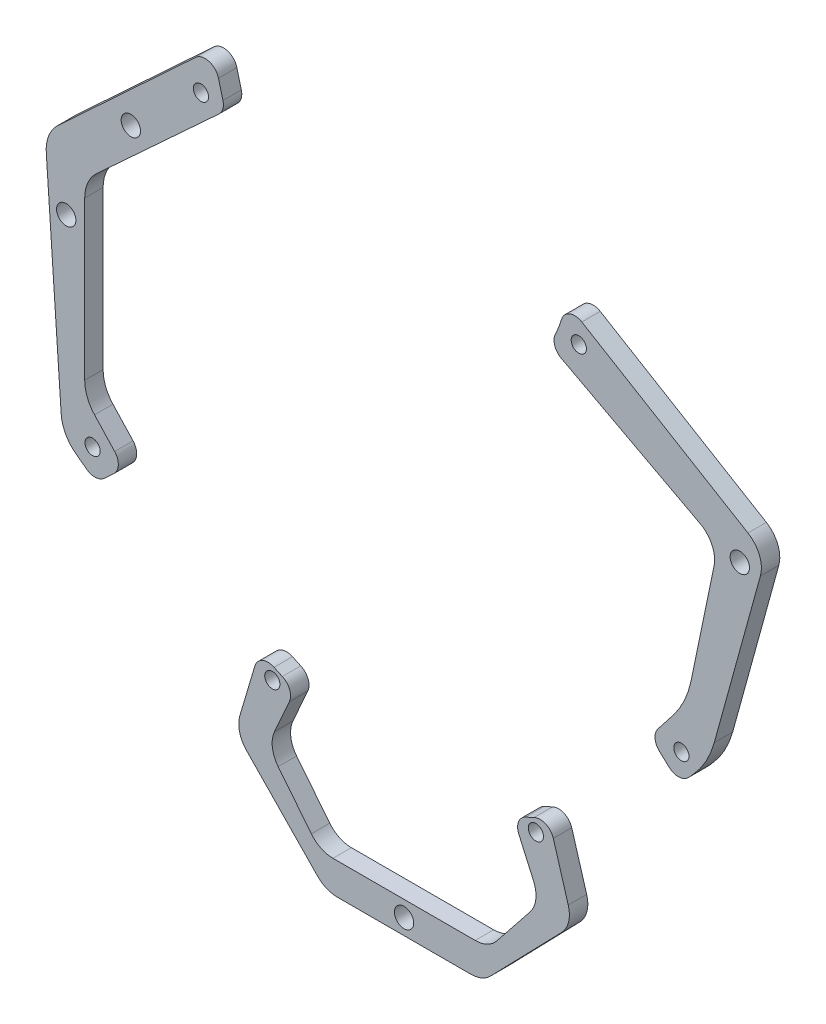
from build123d import *

# Parameters (mm, degrees)
SKETCH_1_R      = 1.65
SKETCH_1_R_2    = 2.1
EXTRUDE_1_DEPTH = 4
FILLET_1_R      = 20
FILLET_2_R      = 3
FILLET_3_R      = 6
FILLET_4_R      = 3
FILLET_5_R      = 3
FILLET_6_R      = 6
FILLET_7_R      = 6
FILLET_8_R      = 3
FILLET_9_R      = 8


with BuildPart() as part:
    # 草图1 → 凸台-拉伸1 (new body)
    # profile 1 of 5: a face of its own
    with BuildSketch(Plane.XY):
        Polygon((-77.945405083, 2.604841831), (-41.566231945, 36.364781808), (-38.875318831, 26.038559191), (-69.339571839, -2.044157442), (-69.339571839, -42.939996997), (-60.801466828, -52.154864748), (-66.909557952, -57.814362512), (-74.194826339, -52.394150256), align=None)
        with Locations((-44.1, 26.89)):
            Circle(SKETCH_1_R, mode=Mode.SUBTRACT)
        with Locations((-67.632870637, -51.487254798)):
            Circle(SKETCH_1_R, mode=Mode.SUBTRACT)
        with Locations((-59.326738736, 13.103569808)):
            Circle(SKETCH_1_R_2, mode=Mode.SUBTRACT)
        with Locations((-73.356046193, -10.69429247)):
            Circle(SKETCH_1_R_2, mode=Mode.SUBTRACT)
    # profile 2 of 5: a face of its own
    with BuildSketch(Plane.XY):
        with BuildLine():
            ThreePointArc((31.376803603, 17.505732499), (33.128070546, 20.566305741), (34.314610381, 23.886873116))
            Line((34.314610381, 23.886873116), (35.166942334, 27.157647426))
            Line((35.166942334, 27.157647426), (78.569062885, 1.124085584))
            Line((78.569062885, 1.124085584), (66.046380792, -44.316295638))
            Line((66.046380792, -44.316295638), (59.715665593, -51.148807449))
            Line((59.715665593, -51.148807449), (53.416137419, -45.311932247))
            Line((53.416137419, -45.311932247), (61.341189712, -35.154345924))
            Line((61.341189712, -35.154345924), (68.210178439, -2.044157442))
            Line((68.210178439, -2.044157442), (31.376803603, 17.505732499))
        make_face()
        with Locations((37.929803622, 20.552893435)):
            Circle(SKETCH_1_R, mode=Mode.SUBTRACT)
        with Locations((60.201437699, -44.933461153)):
            Circle(SKETCH_1_R, mode=Mode.SUBTRACT)
        with Locations((72.892421676, -2.924569169)):
            Circle(SKETCH_1_R_2, mode=Mode.SUBTRACT)
    # profile 3 of 5: a face of its own
    with BuildSketch(Plane.XY):
        with BuildLine():
            Line((36.641886012, -89.35704275), (31.376803603, -71.627696822))
            ThreePointArc((31.376803603, -71.627696822), (27.572746465, -73.545827587), (23.652041706, -75.212606079))
            Line((23.652041706, -75.212606079), (29.612111549, -88.598929818))
            Line((29.612111549, -88.598929818), (18.333166842, -102.74766519))
            Line((18.333166842, -102.74766519), (6.109482288, -102.74766519))
            ThreePointArc((6.109482288, -102.74766519), (6.773713015, -104.398972349), (7, -106.164421864))
            ThreePointArc((7, -106.164421864), (6.773713015, -107.92987138), (6.109482288, -109.581178539))
            Line((6.109482288, -109.581178539), (17.028290172, -109.581178539))
            Line((17.028290172, -109.581178539), (36.641886012, -89.35704275))
        make_face()
        with Locations((28.610131123, -75.820370589)):
            Circle(SKETCH_1_R, mode=Mode.SUBTRACT)
    # profile 4 of 5: a face of its own
    with BuildSketch(Plane.XY):
        with BuildLine():
            Line((-17.028290172, -109.581178539), (-6.109482288, -109.581178539))
            ThreePointArc((-6.109482288, -109.581178539), (-7, -106.164421864), (-6.109482288, -102.74766519))
            Line((-6.109482288, -102.74766519), (-18.333166842, -102.74766519))
            Line((-18.333166842, -102.74766519), (-29.612111549, -88.598929818))
            Line((-29.612111549, -88.598929818), (-23.652041706, -75.212606079))
            ThreePointArc((-23.652041706, -75.212606079), (-27.572746465, -73.545827587), (-31.376803603, -71.627696822))
            Line((-31.376803603, -71.627696822), (-36.641886012, -89.35704275))
            Line((-36.641886012, -89.35704275), (-17.028290172, -109.581178539))
        make_face()
        with Locations((-28.610131123, -75.820370589)):
            Circle(SKETCH_1_R, mode=Mode.SUBTRACT)
    # profile 5 of 5: a face of its own
    with BuildSketch(Plane.XY):
        with BuildLine():
            Line((-6.109482288, -109.581178539), (6.109482288, -109.581178539))
            ThreePointArc((6.109482288, -109.581178539), (6.773713015, -107.92987138), (7, -106.164421864))
            ThreePointArc((7, -106.164421864), (6.773713015, -104.398972349), (6.109482288, -102.74766519))
            Line((6.109482288, -102.74766519), (-6.109482288, -102.74766519))
            ThreePointArc((-6.109482288, -102.74766519), (-7, -106.164421864), (-6.109482288, -109.581178539))
        make_face()
        with Locations((0, -106.164421864)):
            Circle(SKETCH_1_R_2, mode=Mode.SUBTRACT)
    extrude(amount=EXTRUDE_1_DEPTH)

    # 圆角1
    fillet_1_edges = [part.edges().sort_by_distance(p)[0] for p in [
        (66.046380792, -44.316295638, 2),
        (61.341189712, -35.154345924, 2),
    ]]
    fillet(fillet_1_edges, radius=FILLET_1_R)

    # 圆角2
    fillet_2_edges = [part.edges().sort_by_distance(p)[0] for p in [
        (59.715665593, -51.148807449, 2),
        (53.416137419, -45.311932247, 2),
    ]]
    fillet(fillet_2_edges, radius=FILLET_2_R)

    # 圆角3
    fillet_3_edges = [part.edges().sort_by_distance(p)[0] for p in [
        (78.569062885, 1.124085584, 2),
        (68.210178439, -2.044157442, 2),
    ]]
    fillet(fillet_3_edges, radius=FILLET_3_R)

    # 圆角4
    fillet_4_edges = [part.edges().sort_by_distance(p)[0] for p in [
        (35.166942334, 27.157647426, 2),
        (31.376803603, 17.505732499, 2),
    ]]
    fillet(fillet_4_edges, radius=FILLET_4_R)

    # 圆角5
    fillet_5_edges = [part.edges().sort_by_distance(p)[0] for p in [
        (31.376803603, -71.627696822, 2),
        (-31.376803603, -71.627696822, 2),
        (-23.652041706, -75.212606079, 2),
        (23.652041706, -75.212606079, 2),
    ]]
    fillet(fillet_5_edges, radius=FILLET_5_R)

    # 圆角6
    fillet_6_edges = [part.edges().sort_by_distance(p)[0] for p in [
        (36.641886012, -89.35704275, 2),
        (-36.641886012, -89.35704275, 2),
        (-29.612111549, -88.598929818, 2),
        (29.612111549, -88.598929818, 2),
    ]]
    fillet(fillet_6_edges, radius=FILLET_6_R)

    # 圆角7
    fillet_7_edges = [part.edges().sort_by_distance(p)[0] for p in [
        (17.028290172, -109.581178539, 2),
        (-17.028290172, -109.581178539, 2),
        (-18.333166842, -102.74766519, 2),
        (18.333166842, -102.74766519, 2),
    ]]
    fillet(fillet_7_edges, radius=FILLET_7_R)

    # 圆角8
    fillet_8_edges = [part.edges().sort_by_distance(p)[0] for p in [
        (-41.566231945, 36.364781808, 2),
        (-38.875318831, 26.038559191, 2),
        (-60.801466828, -52.154864748, 2),
        (-66.909557952, -57.814362512, 2),
    ]]
    fillet(fillet_8_edges, radius=FILLET_8_R)

    # 圆角9
    fillet_9_edges = [part.edges().sort_by_distance(p)[0] for p in [
        (-69.339571839, -2.044157442, 2),
        (-69.339571839, -42.939996997, 2),
        (-74.194826339, -52.394150256, 2),
        (-77.945405083, 2.604841831, 2),
    ]]
    fillet(fillet_9_edges, radius=FILLET_9_R)


solid = part.part
